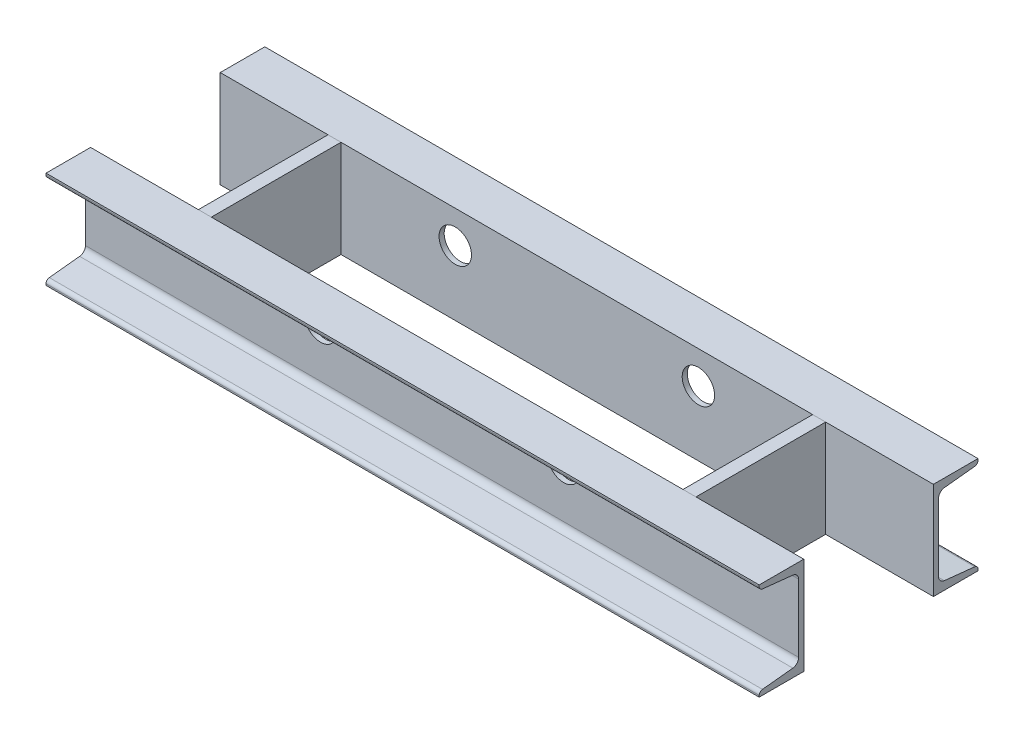
from build123d import *

# Parameters (mm, degrees)
C_CHANNEL_120_X_12_1_DEPTH = 880
C_CHANNEL_120_X_12_2_DEPTH = 880
CUT_EXTRUDE3_DEPTH         = 507.925724342
CUT_EXTRUDE3_DEPTH_BACK    = 507.925724342
SKETCH18_R                 = 20
BOSS_EXTRUDE1_REACH        = 506.207
SKETCH19_W                 = 16
SKETCH19_H                 = 120


with BuildPart() as part:
    # Sketch13 → C channel 120 X 12(1) (new body)
    with BuildSketch(Plane(origin=(-440, 0, 0), x_dir=(0, 0, 1), z_dir=(1, 0, 0))):
        with BuildLine():
            Line((55, 120), (0, 120))
            Line((0, 120), (0, 0))
            Line((0, 0), (55, 0))
            Line((55, 0), (55, 1.896373189))
            ThreePointArc((55, 1.896373189), (53.844151715, 4.907460917), (50.970378085, 6.371721718))
            Line((50.970378085, 6.371721718), (13.463772294, 10.313824837))
            ThreePointArc((13.463772294, 10.313824837), (8.354841396, 12.916955149), (6.3, 18.27))
            Line((6.3, 18.27), (6.3, 101.74))
            ThreePointArc((6.3, 101.74), (8.354841396, 107.093044851), (13.463772294, 109.696175163))
            Line((13.463772294, 109.696175163), (50.970378085, 113.638278282))
            ThreePointArc((50.970378085, 113.638278282), (53.844151715, 115.102539083), (55, 118.113626811))
            Line((55, 118.113626811), (55, 120))
        make_face()
    extrude(amount=C_CHANNEL_120_X_12_1_DEPTH)


with BuildPart() as body_2:
    # Sketch16 → C channel 120 X 12(2) (new body)
    with BuildSketch(Plane(origin=(440, 0, -160), x_dir=(0, 0, -1), z_dir=(-1, 0, 0))):
        with BuildLine():
            Line((55, 120), (0, 120))
            Line((0, 120), (0, 0))
            Line((0, 0), (55, 0))
            Line((55, 0), (55, 1.896373189))
            ThreePointArc((55, 1.896373189), (53.844151715, 4.907460917), (50.970378085, 6.371721718))
            Line((50.970378085, 6.371721718), (13.463772294, 10.313824837))
            ThreePointArc((13.463772294, 10.313824837), (8.354841396, 12.916955149), (6.3, 18.27))
            Line((6.3, 18.27), (6.3, 101.74))
            ThreePointArc((6.3, 101.74), (8.354841396, 107.093044851), (13.463772294, 109.696175163))
            Line((13.463772294, 109.696175163), (50.970378085, 113.638278282))
            ThreePointArc((50.970378085, 113.638278282), (53.844151715, 115.102539083), (55, 118.113626811))
            Line((55, 118.113626811), (55, 120))
        make_face()
    extrude(amount=C_CHANNEL_120_X_12_2_DEPTH)


with BuildPart() as cut_extrude3_tool:
    # Sketch18 → Cut-Extrude3 (new, two sides: drawn at the far end of the back side and taken through both)
    with BuildSketch(Plane.XY.offset(6.3).offset(-CUT_EXTRUDE3_DEPTH_BACK)):
        with Locations((-150, -40)):
            Circle(SKETCH18_R)
        with Locations((150, -40)):
            Circle(SKETCH18_R)
    extrude(amount=CUT_EXTRUDE3_DEPTH + CUT_EXTRUDE3_DEPTH_BACK)


with BuildPart() as part_1:
    add(part.part)

    # Cut-Extrude3: cut by cut_extrude3_tool
    add(cut_extrude3_tool.part, mode=Mode.SUBTRACT)


with BuildPart() as body_2_1:
    add(body_2.part)

    # Cut-Extrude3: cut by cut_extrude3_tool
    add(cut_extrude3_tool.part, mode=Mode.SUBTRACT)


with BuildPart() as body_3:

    # Sketch19 → Boss-Extrude1 (new, up to next)
    with BuildSketch(Plane(origin=(0, 0, 0), x_dir=(-1, 0, 0), z_dir=(0, 0, -1)), mode=Mode.PRIVATE) as boss_extrude1_sk1:
        with Locations((-299, -60)):
            Rectangle(SKETCH19_W, SKETCH19_H)
    boss_extrude1_tool1 = extrude(boss_extrude1_sk1.sketch, amount=BOSS_EXTRUDE1_REACH, mode=Mode.PRIVATE) - body_2_1.part
    # Sketch19 → Boss-Extrude1 (new, up to next)
    with BuildSketch(Plane(origin=(0, 0, 0), x_dir=(-1, 0, 0), z_dir=(0, 0, -1)), mode=Mode.PRIVATE) as boss_extrude1_sk2:
        with Locations((299, -60)):
            Rectangle(SKETCH19_W, SKETCH19_H)
    boss_extrude1_tool2 = extrude(boss_extrude1_sk2.sketch, amount=BOSS_EXTRUDE1_REACH, mode=Mode.PRIVATE) - body_2_1.part
    add(boss_extrude1_tool1.solids().sort_by_distance((299, -60, 0))[0])
    add(boss_extrude1_tool2.solids().sort_by_distance((-299, -60, 0))[0])


solid = Compound([part_1.part, body_2_1.part, body_3.part])
